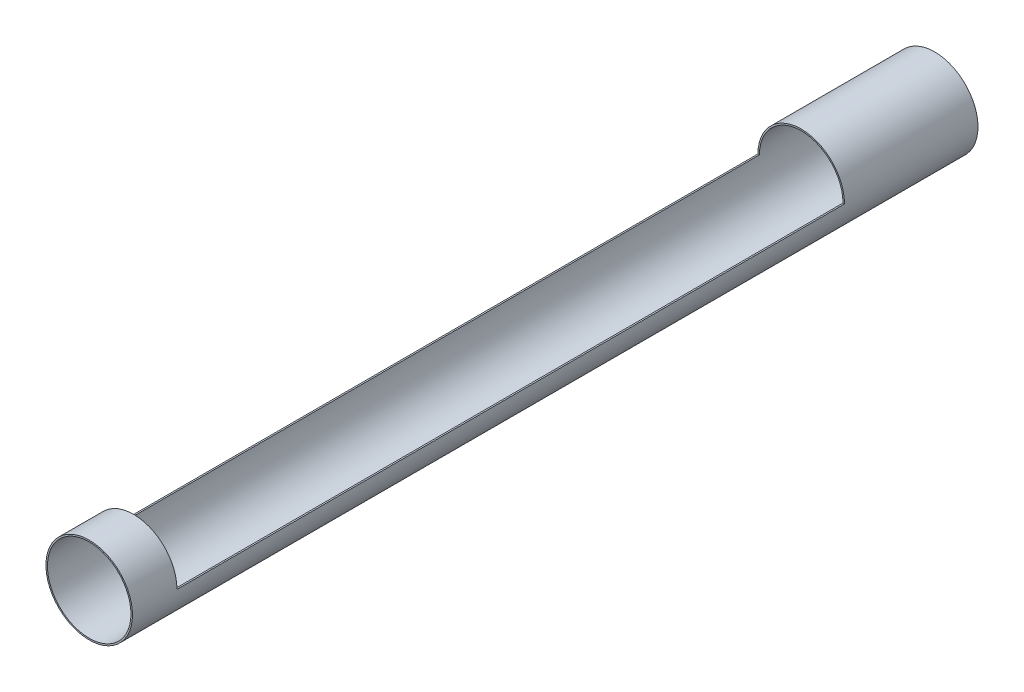
from build123d import *

# Parameters (mm, degrees)
SKETCH1_R           = 49.403
SKETCH1_R_2         = 47.6885
BOSS_EXTRUDE1_DEPTH = 152.4
BOSS_EXTRUDE2_DEPTH = 762
SKETCH3_R           = 49.403
SKETCH3_R_2         = 47.6885
BOSS_EXTRUDE3_DEPTH = 50.8


with BuildPart() as part:
    # Sketch1 → Boss-Extrude1 (new body)
    with BuildSketch(Plane.XY):
        with Locations(Location((0, 0, 0), (0, 0, 180))):
            Circle(SKETCH1_R)
        with Locations(Location((0, 0, 0), (0, 0, 180))):
            Circle(SKETCH1_R_2, mode=Mode.SUBTRACT)
    extrude(amount=BOSS_EXTRUDE1_DEPTH)

    # Sketch2 → Boss-Extrude2 (add)
    with BuildSketch(Plane.XY.offset(152.4)):
        with BuildLine():
            Line((-49.403, 0), (-47.6885, 0))
            ThreePointArc((-47.6885, 0), (0, -47.6885), (47.6885, 0))
            Line((47.6885, 0), (49.403, 0))
            ThreePointArc((49.403, 0), (0, -49.403), (-49.403, 0))
        make_face()
    extrude(amount=BOSS_EXTRUDE2_DEPTH)

    # Sketch3 → Boss-Extrude3 (add)
    with BuildSketch(Plane.XY.offset(914.4)):
        Circle(SKETCH3_R)
        Circle(SKETCH3_R_2, mode=Mode.SUBTRACT)
    extrude(amount=BOSS_EXTRUDE3_DEPTH)


solid = part.part
